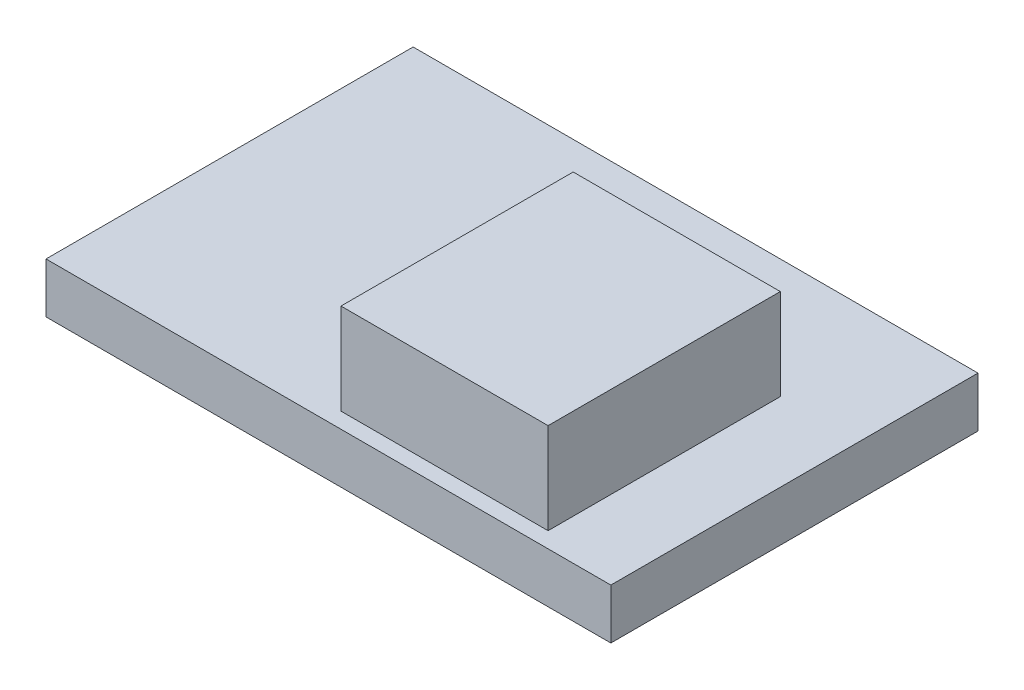
from build123d import *

# Parameters (mm, degrees)
SKETCH1_W           = 18
SKETCH1_H           = 11.7
BOSS_EXTRUDE1_DEPTH = 1.6
SKETCH2_W           = 6.6
SKETCH2_H           = 7.4
BOSS_EXTRUDE2_DEPTH = 2.9


with BuildPart() as part:
    # Sketch1 → Boss-Extrude1 (new body)
    with BuildSketch(Plane(origin=(0, 0, 0), x_dir=(1, 0, 0), z_dir=(0, 1, 0))):
        Rectangle(SKETCH1_W, SKETCH1_H)
    extrude(amount=BOSS_EXTRUDE1_DEPTH)

    # Sketch2 → Boss-Extrude2 (add)
    with BuildSketch(Plane(origin=(0, 1.6, 0), x_dir=(1, 0, 0), z_dir=(0, 1, 0))):
        with Locations((3.2, -1.65)):
            Rectangle(SKETCH2_W, SKETCH2_H)
    extrude(amount=BOSS_EXTRUDE2_DEPTH)


solid = part.part
